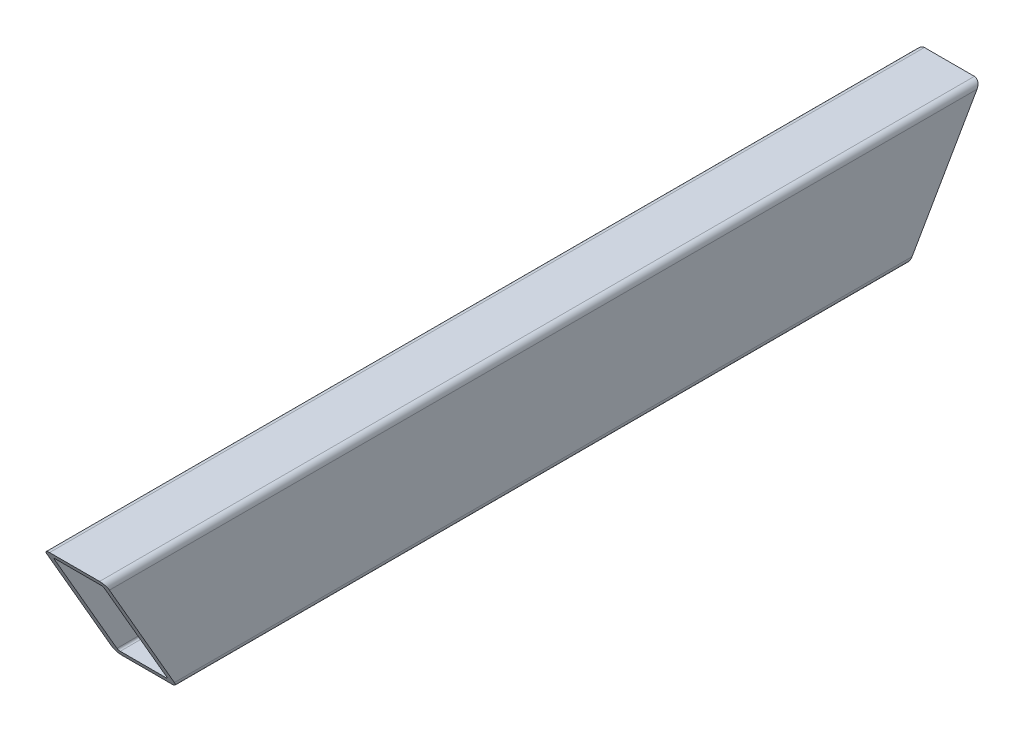
from build123d import *

# Parameters (mm, degrees)
DODANIE_WYCI_GNI_CIE1_DEPTH = 420
WYTNIJ_WYCI_GNI_CIE1_REACH  = 427.323


with BuildPart() as part:
    # Szkic1 → Dodanie-wyciągnięcie1 (new body)
    with BuildSketch(Plane.XY):
        with BuildLine():
            Line((-12, -60), (12, -60))
            ThreePointArc((12, -60), (14.121320344, -59.121320344), (15, -57))
            Line((15, -57), (15, -3))
            ThreePointArc((15, -3), (14.121320344, -0.878679656), (12, 0))
            Line((12, 0), (-12, 0))
            ThreePointArc((-12, 0), (-14.121320344, -0.878679656), (-15, -3))
            Line((-15, -3), (-15, -57))
            ThreePointArc((-15, -57), (-14.121320344, -59.121320344), (-12, -60))
        make_face()
        with BuildLine():
            Line((-11, -3), (11, -3))
            ThreePointArc((11, -3), (11.707106781, -3.292893219), (12, -4))
            Line((12, -4), (12, -56))
            ThreePointArc((12, -56), (11.707106781, -56.707106781), (11, -57))
            Line((11, -57), (-11, -57))
            ThreePointArc((-11, -57), (-11.707106781, -56.707106781), (-12, -56))
            Line((-12, -56), (-12, -4))
            ThreePointArc((-12, -4), (-11.707106781, -3.292893219), (-11, -3))
        make_face(mode=Mode.SUBTRACT)
    extrude(amount=-DODANIE_WYCI_GNI_CIE1_DEPTH)

    # Wytnij-wyciągnięcie1: up to this face of the body (flat: up to its plane)
    wytnij_wyci_gni_cie1_end = Plane(part.part.faces().sort_by_distance((-15, -30, -210))[0])
    # Szkic2 → Wytnij-wyciągnięcie1 (cut, up to the picked face)
    with BuildSketch(Plane(origin=(15, 0, 0), x_dir=(0, 0, -1), z_dir=(1, 0, 0)), mode=Mode.PRIVATE) as wytnij_wyci_gni_cie1_sk1:
        Polygon((0, -60), (34.641016151, -60), (0, 0), align=None)
    wytnij_wyci_gni_cie1_tool1 = split(extrude(wytnij_wyci_gni_cie1_sk1.sketch, amount=-WYTNIJ_WYCI_GNI_CIE1_REACH, mode=Mode.PRIVATE), bisect_by=wytnij_wyci_gni_cie1_end, keep=Keep.BOTH, mode=Mode.PRIVATE)
    # Szkic2 → Wytnij-wyciągnięcie1 (cut, up to the picked face)
    with BuildSketch(Plane(origin=(15, 0, 0), x_dir=(0, 0, -1), z_dir=(1, 0, 0)), mode=Mode.PRIVATE) as wytnij_wyci_gni_cie1_sk2:
        Polygon((420, -60), (420, 0), (385.358983849, -60), align=None)
    wytnij_wyci_gni_cie1_tool2 = split(extrude(wytnij_wyci_gni_cie1_sk2.sketch, amount=-WYTNIJ_WYCI_GNI_CIE1_REACH, mode=Mode.PRIVATE), bisect_by=wytnij_wyci_gni_cie1_end, keep=Keep.BOTH, mode=Mode.PRIVATE)
    add(wytnij_wyci_gni_cie1_tool1.solids().sort_by(Axis((15, -40, -11.547005), (-1, 0, 0)))[0], mode=Mode.SUBTRACT)
    add(wytnij_wyci_gni_cie1_tool2.solids().sort_by(Axis((15, -40, -408.452995), (-1, 0, 0)))[0], mode=Mode.SUBTRACT)


solid = part.part
